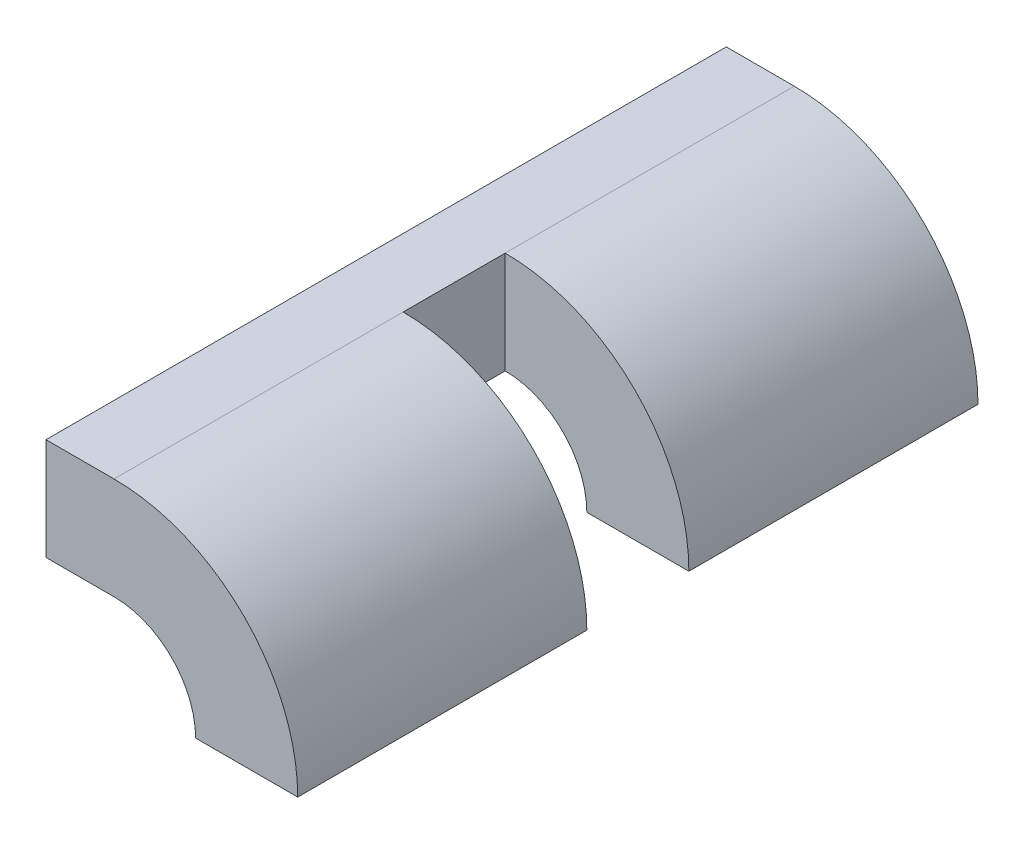
from build123d import *

# Parameters (mm, degrees)
SKETCH_1_W          = 20
SKETCH_1_H          = 30
EXTRUDE_1_DEPTH     = 200
EXTRUDE_2_DEPTH     = 200
SKETCH_2_W          = 30
SKETCH_2_H          = 79.389115132
CUT_EXTRUDE_1_DEPTH = 54


with BuildPart() as part:
    # 草图1 → 凸台-拉伸1 (new body)
    with BuildSketch(Plane.XY):
        with Locations((10, 15)):
            Rectangle(SKETCH_1_W, SKETCH_1_H)
    extrude(amount=EXTRUDE_1_DEPTH)

    # 草图1<3> → 凸台-拉伸2 (add)
    with BuildSketch(Plane.XY):
        with BuildLine():
            ThreePointArc((20, 0), (36.970562748, -7.029437252), (44, -24))
            Line((44, -24), (74, -24))
            ThreePointArc((74, -24), (58.183766184, 14.183766184), (20, 30))
            Line((20, 30), (20, 0))
        make_face()
    extrude(amount=EXTRUDE_2_DEPTH)

    # 草图2 → 切除-拉伸1 (cut)
    with BuildSketch(Plane(origin=(74, 0, 0), x_dir=(0, 0, -1), z_dir=(1, 0, 0))):
        with Locations((-100, 15.694557566)):
            Rectangle(SKETCH_2_W, SKETCH_2_H)
    extrude(amount=-CUT_EXTRUDE_1_DEPTH, mode=Mode.SUBTRACT)


solid = part.part
